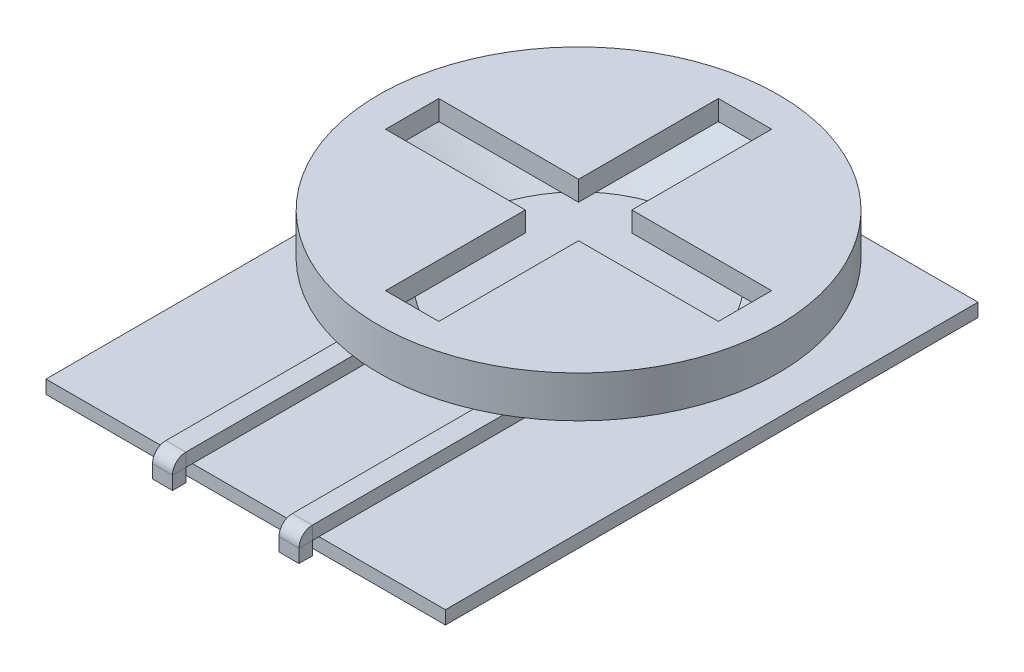
from build123d import *

# Parameters (mm, degrees)
SKETCH2_W           = 3
SKETCH2_H           = 4
BOSS_EXTRUDE1_DEPTH = 0.1
SHELL2_T            = -0.15
SKETCH5_W           = 0.4
SKETCH5_H           = 1.05
SKETCH5_H_2         = 0.4
SKETCH5_W_2         = 1.05
CUT_EXTRUDE1_DEPTH  = 0.15
BOSS_EXTRUDE2_DEPTH = 0.1
SKETCH7_R           = 0.873205081
BOSS_EXTRUDE3_DEPTH = 0.1
SKETCH9_W           = 0.15
SKETCH9_H           = 0.1


with BuildPart() as part:
    # Sketch2 → Boss-Extrude1 (new body)
    with BuildSketch(Plane(origin=(0, 0, 0), x_dir=(1, 0, 0), z_dir=(0, 1, 0))):
        Rectangle(SKETCH2_W, SKETCH2_H)
    extrude(amount=BOSS_EXTRUDE1_DEPTH)


with BuildPart() as body_2:
    # Sketch4 → Revolve1 (revolve)
    with BuildSketch(Plane(origin=(0, 0, 0), x_dir=(0, 0, -1), z_dir=(1, 0, 0))):
        Polygon((0.5, 0.1), (0.5, 0.7), (2, 0.7), (2, 0.388675135), (1.5, 0.1), align=None)
    revolve(axis=Axis((0, 0.1, -0.5), (0, 1, 0)))

    # Shell2
    shell2_openings = [body_2.faces().sort_by_distance(p)[0] for p in [
        (0, 0.1, -0.5),
    ]]
    offset(amount=SHELL2_T, openings=shell2_openings, kind=Kind.INTERSECTION)

    # Sketch5 → Cut-Extrude1 (cut)
    with BuildSketch(Plane(origin=(0, 0.7, 0), x_dir=(1, 0, 0), z_dir=(0, 1, 0))):
        with Locations((0, 1.225)):
            Rectangle(SKETCH5_W, SKETCH5_H)
        with Locations((0, 0.5)):
            Rectangle(SKETCH5_W, SKETCH5_H_2)
        with Locations((0.725, 0.5)):
            Rectangle(SKETCH5_W_2, SKETCH5_H_2)
        with Locations((0, -0.225)):
            Rectangle(SKETCH5_W, SKETCH5_H)
        with Locations((-0.725, 0.5)):
            Rectangle(SKETCH5_W_2, SKETCH5_H_2)
    extrude(amount=-CUT_EXTRUDE1_DEPTH, mode=Mode.SUBTRACT)

    # Sketch6 → Boss-Extrude2 (add)
    with BuildSketch(Plane(origin=(0, 0.1, 0), x_dir=(1, 0, 0), z_dir=(0, 1, 0))):
        with BuildLine():
            Line((-0.55, 0.066987298), (-0.55, -2))
            Line((-0.55, -2), (-0.4, -2))
            Line((-0.4, -2), (-0.4, -0.074456265))
            ThreePointArc((-0.4, -0.074456265), (-0.480235953, -0.009287178), (-0.55, 0.066987298))
        make_face()
        with BuildLine():
            Line((0.55, 0.066987298), (0.55, -2))
            Line((0.55, -2), (0.4, -2))
            Line((0.4, -2), (0.4, -0.074456265))
            ThreePointArc((0.4, -0.074456265), (0.480235953, -0.009287178), (0.55, 0.066987298))
        make_face()
    extrude(amount=BOSS_EXTRUDE2_DEPTH)

    # Sketch7 → Boss-Extrude3 (add)
    with BuildSketch(Plane(origin=(0, 0.1, 0), x_dir=(1, 0, 0), z_dir=(0, 1, 0))):
        with Locations((0, 0.5)):
            Circle(SKETCH7_R)
    extrude(amount=BOSS_EXTRUDE3_DEPTH)


with BuildPart() as body_3:
    # Sweep1: sweep along a path in Sketch8
    with BuildLine(Plane(origin=(0.475, 0, 0), x_dir=(0, 0, -1), z_dir=(1, 0, 0))) as sweep1_path:
        Line((-2, 0.15), (-2.05, 0.15))
        ThreePointArc((-2.05, 0.15), (-2.085355339, 0.135355339), (-2.1, 0.1))
        Line((-2.1, 0.1), (-2.1, 0))
    # Sketch9 → Sweep1 (sweep)
    with BuildSketch(Plane.XY.offset(2)):
        with Locations((0.475, 0.15)):
            Rectangle(SKETCH9_W, SKETCH9_H)
    sweep(path=sweep1_path.line)


with BuildPart() as body_4:
    # Mirror1: mirrored copy
    add(body_3.part.mirror(Plane(origin=(0, 0, 0), x_dir=(0, 0, 1), z_dir=(1, 0, 0))))

    # Combine1: union body 3, body 2
    add(body_3.part)
    add(body_2.part)


solid = Compound([part.part, body_4.part])
